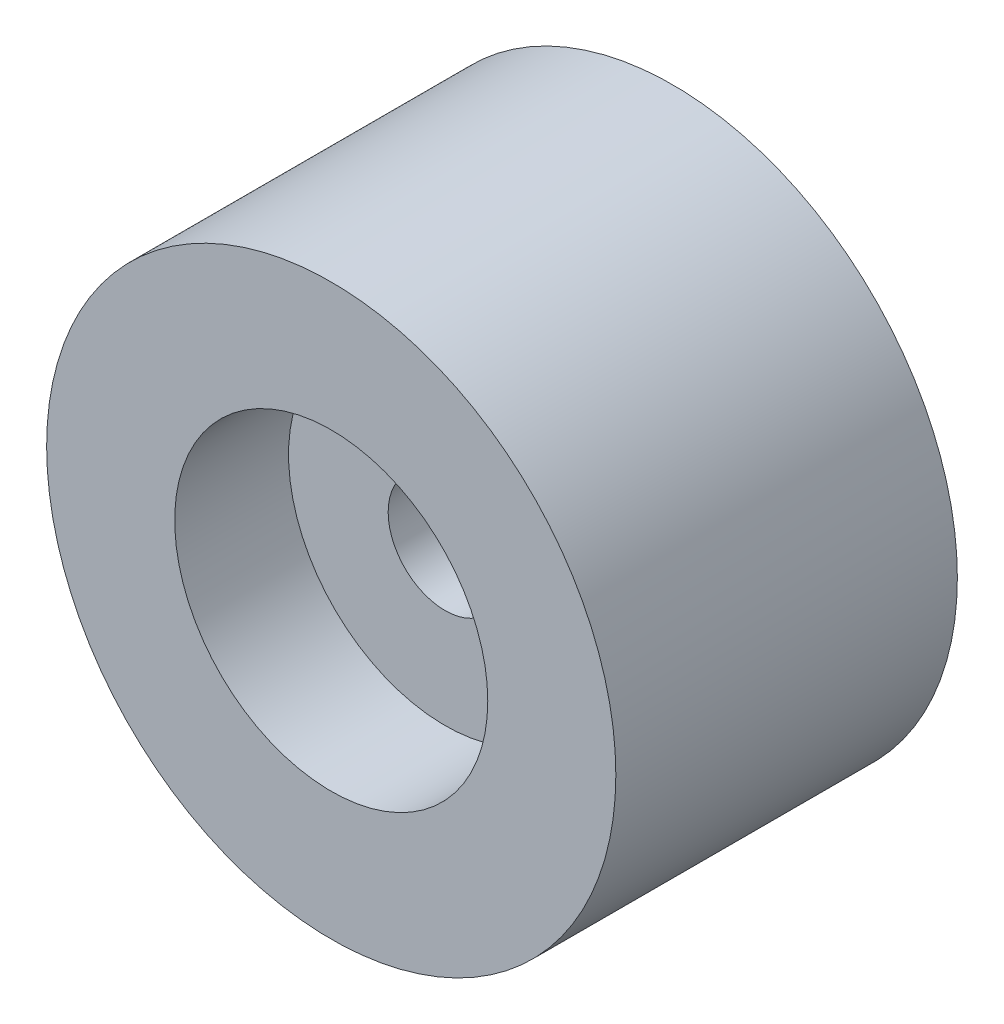
from build123d import *

# Parameters (mm, degrees)
SKETCH1_R          = 20
SKETCH1_R_2        = 4
EXTRUDE1_DEPTH     = 24
SKETCH2_R          = 11
CUT_EXTRUDE1_DEPTH = 8
CUT_EXTRUDE2_START = -8
SKETCH3_R          = 11
CUT_EXTRUDE2_DEPTH = 8


with BuildPart() as part:
    # Sketch1 → Extrude1 (new body)
    with BuildSketch(Plane.XY):
        Circle(SKETCH1_R)
        Circle(SKETCH1_R_2, mode=Mode.SUBTRACT)
    extrude(amount=EXTRUDE1_DEPTH)

    # Sketch2 → Cut-Extrude1 (cut)
    with BuildSketch(Plane.XY.offset(24)):
        Circle(SKETCH2_R)
    extrude(amount=-CUT_EXTRUDE1_DEPTH, mode=Mode.SUBTRACT)

    # Sketch3 → Cut-Extrude2 (cut)
    with BuildSketch(Plane(origin=(0, 0, 0), x_dir=(-1, 0, 0), z_dir=(0, 0, -1)).offset(CUT_EXTRUDE2_START)):
        with Locations(Location((0, 0, 0), (0, 0, 180))):
            Circle(SKETCH3_R)
    extrude(amount=CUT_EXTRUDE2_DEPTH, mode=Mode.SUBTRACT)


solid = part.part
